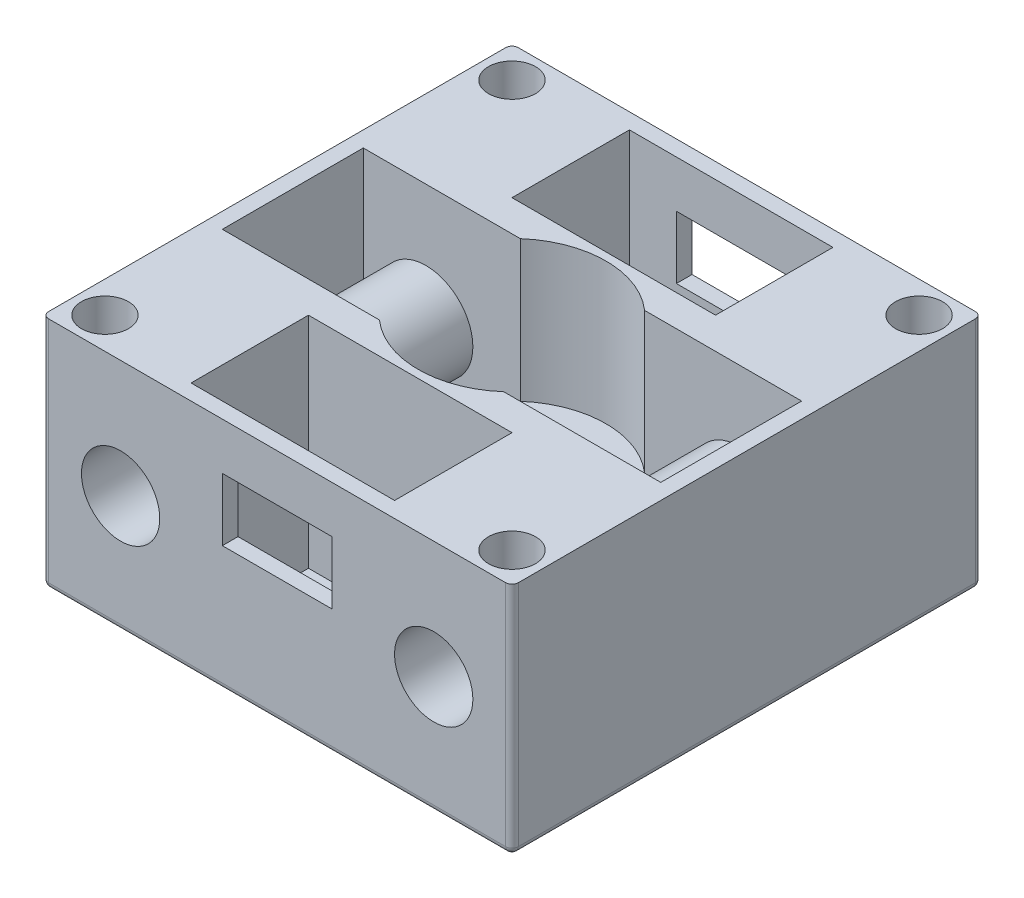
from build123d import *

# Parameters (mm, degrees)
SKETCH_2_W                      = 15
SKETCH_2_H                      = 15
EXTRUDE_1_DEPTH                 = 7.5
SKETCH_3_W                      = 14
SKETCH_3_H                      = 4.5
CUT_EXTRUDE_1_DEPTH             = 7
SKETCH_4_R                      = 3
CUT_EXTRUDE_2_DEPTH             = 4.5
SKETCH_5_W                      = 6.5
SKETCH_5_H                      = 3.75
CUT_EXTRUDE_3_DEPTH             = 7
EXTRUDE_2_REACH                 = 20.371
SKETCH_6_R                      = 1.5
SKETCH_7_R                      = 1.25
CUT_EXTRUDE_4_DEPTH             = 19.371173071
SKETCH_8_W                      = 3
SKETCH_8_H                      = 3
EXTRUDE_3_DEPTH                 = 1
CUT_EXTRUDE_5_REACH             = 20.371
SKETCH_9_W                      = 3.5
SKETCH_9_H                      = 2
CUT_EXTRUDE_6_REACH             = 35.371
CUT_EXTRUDE_START               = -15
SKETCH_9_2_W                    = 3.5
SKETCH_9_2_H                    = 2
EXTRUDE_4_DEPTH                 = 2
EXTRUDE_4_DEPTH_BACK            = 2
CUT_EXTRUDE_7_REACH             = 14.99
CUT_EXTRUDE_7_DIRECTION_2_REACH = 14.99
FILLET_1_R                      = 0.1
FILLET_2_R                      = 0.2
SKETCH_12_R                     = 0.75
CUT_EXTRUDE_8_DEPTH             = 2


with BuildPart() as part:
    # 草图2 → 凸台-拉伸1 (new body)
    with BuildSketch(Plane(origin=(0, 0, 0), x_dir=(1, 0, 0), z_dir=(0, 1, 0))):
        Rectangle(SKETCH_2_W, SKETCH_2_H)
    extrude(amount=EXTRUDE_1_DEPTH)

    # 草图3 → 切除-拉伸1 (cut)
    with BuildSketch(Plane(origin=(0, 7.5, 0), x_dir=(-1, 0, 0), z_dir=(0, 1, 0))):
        Rectangle(SKETCH_3_W, SKETCH_3_H)
    extrude(amount=-CUT_EXTRUDE_1_DEPTH, mode=Mode.SUBTRACT)

    # 草图4 → 切除-拉伸2 (cut)
    with BuildSketch(Plane(origin=(0, 7.5, 0), x_dir=(1, 0, 0), z_dir=(0, 1, 0))):
        Circle(SKETCH_4_R)
    extrude(amount=-CUT_EXTRUDE_2_DEPTH, mode=Mode.SUBTRACT)

    # 草图5 → 切除-拉伸3 (cut)
    with BuildSketch(Plane(origin=(0, 7.5, 0), x_dir=(-1, 0, 0), z_dir=(0, 1, 0))):
        with Locations((0, -5.125)):
            Rectangle(SKETCH_5_W, SKETCH_5_H)
        with Locations((0, 5.125)):
            Rectangle(SKETCH_5_W, SKETCH_5_H)
    extrude(amount=-CUT_EXTRUDE_3_DEPTH, mode=Mode.SUBTRACT)

    # 草图6 → 凸台-拉伸2 (add, up to next)
    with BuildSketch(Plane.XY.offset(7.5), mode=Mode.PRIVATE) as extrude_2_sk1:
        with Locations((-5, 3.75)):
            Circle(SKETCH_6_R)
    extrude_2_tool1 = extrude(extrude_2_sk1.sketch, amount=-EXTRUDE_2_REACH, mode=Mode.PRIVATE) - part.part
    # 草图6 → 凸台-拉伸2 (add, up to next)
    with BuildSketch(Plane.XY.offset(7.5), mode=Mode.PRIVATE) as extrude_2_sk2:
        with Locations((5, 3.75)):
            Circle(SKETCH_6_R)
    extrude_2_tool2 = extrude(extrude_2_sk2.sketch, amount=-EXTRUDE_2_REACH, mode=Mode.PRIVATE) - part.part
    add(extrude_2_tool1.solids().sort_by_distance((-5, 3.75, 7.5))[0])
    add(extrude_2_tool2.solids().sort_by_distance((5, 3.75, 7.5))[0])

    # 草图7 → 切除-拉伸4 (cut, through all)
    with BuildSketch(Plane.XY.offset(7.5)):
        with Locations((-5, 3.75)):
            Circle(SKETCH_7_R)
        with Locations((5, 3.75)):
            Circle(SKETCH_7_R)
    extrude(amount=-CUT_EXTRUDE_4_DEPTH, mode=Mode.SUBTRACT)

    # 草图8 → 凸台-拉伸3 (add)
    with BuildSketch(Plane.XZ):
        Rectangle(SKETCH_8_W, SKETCH_8_H)
    extrude(amount=EXTRUDE_3_DEPTH)

    # 草图9 → 切除-拉伸5 (cut, up to next)
    with BuildSketch(Plane.XY.offset(7.5), mode=Mode.PRIVATE) as cut_extrude_5_sk1:
        with Locations((0, 5)):
            Rectangle(SKETCH_9_W, SKETCH_9_H)
    cut_extrude_5_tool1 = extrude(cut_extrude_5_sk1.sketch, amount=-CUT_EXTRUDE_5_REACH, mode=Mode.PRIVATE) & part.part
    add(cut_extrude_5_tool1.solids().sort_by_distance((0, 5, 7.5))[0], mode=Mode.SUBTRACT)

    # 草图9<2> → 切除-拉伸6 (cut, up to next)
    with BuildSketch(Plane.XY.offset(7.5).offset(CUT_EXTRUDE_START), mode=Mode.PRIVATE) as cut_extrude_6_sk1:
        with Locations((0, 5)):
            Rectangle(SKETCH_9_2_W, SKETCH_9_2_H)
    cut_extrude_6_tool1 = extrude(cut_extrude_6_sk1.sketch, amount=CUT_EXTRUDE_6_REACH, mode=Mode.PRIVATE) & part.part
    add(cut_extrude_6_tool1.solids().sort_by_distance((0, 5, -7.5))[0], mode=Mode.SUBTRACT)

    # 草图10 → 凸台-拉伸4 (add, two sides: drawn at the far end of the back side and taken through both)
    with BuildSketch(Plane.XY.offset(-EXTRUDE_4_DEPTH_BACK)):
        with BuildLine():
            Line((-1.95, -2.5), (1.95, -2.5))
            Line((1.95, -2.5), (1.95, -1.555590279))
            ThreePointArc((1.95, -1.555590279), (1.780042303, -1.088161527), (1.5, -0.677124344))
            Line((1.5, -0.677124344), (-1.5, -0.677124344))
            ThreePointArc((-1.5, -0.677124344), (-1.780042303, -1.088161527), (-1.95, -1.555590279))
            Line((-1.95, -1.555590279), (-1.95, -2.5))
        make_face()
    extrude(amount=EXTRUDE_4_DEPTH + EXTRUDE_4_DEPTH_BACK)

    # 草图11 → 切除-拉伸7 (cut, up to next)
    with BuildSketch(Plane(origin=(0, 0, 0), x_dir=(0, 0, -1), z_dir=(1, 0, 0)), mode=Mode.PRIVATE) as cut_extrude_7_sk1:
        with BuildLine():
            Line((1.95, -2.5), (1.95, -1.555590279))
            ThreePointArc((1.95, -1.555590279), (1.780042303, -1.088161527), (1.5, -0.677124344))
            Line((1.5, -0.677124344), (2, -0.677124344))
            Line((2, -0.677124344), (2, -2.5))
            Line((2, -2.5), (1.95, -2.5))
        make_face()
    cut_extrude_7_tool1 = extrude(cut_extrude_7_sk1.sketch, amount=-CUT_EXTRUDE_7_REACH, mode=Mode.PRIVATE) & part.part
    # 草图11 → 切除-拉伸7 (cut, up to next)
    with BuildSketch(Plane(origin=(0, 0, 0), x_dir=(0, 0, -1), z_dir=(1, 0, 0)), mode=Mode.PRIVATE) as cut_extrude_7_sk2:
        with BuildLine():
            Line((-1.95, -2.5), (-1.95, -1.555590279))
            ThreePointArc((-1.95, -1.555590279), (-1.780042303, -1.088161527), (-1.5, -0.677124344))
            Line((-1.5, -0.677124344), (-2, -0.677124344))
            Line((-2, -0.677124344), (-2, -2.5))
            Line((-2, -2.5), (-1.95, -2.5))
        make_face()
    cut_extrude_7_tool2 = extrude(cut_extrude_7_sk2.sketch, amount=-CUT_EXTRUDE_7_REACH, mode=Mode.PRIVATE) & part.part
    add(cut_extrude_7_tool1.solids().sort_by_distance((0, -1.175075, -1.873038))[0], mode=Mode.SUBTRACT)
    add(cut_extrude_7_tool2.solids().sort_by_distance((0, -1.175075, 1.873038))[0], mode=Mode.SUBTRACT)

    # 草图11 → 切除-拉伸7 direction 2 (cut, up to next)
    with BuildSketch(Plane(origin=(0, 0, 0), x_dir=(0, 0, -1), z_dir=(1, 0, 0)), mode=Mode.PRIVATE) as cut_extrude_7_direction_2_sk1:
        with BuildLine():
            Line((1.95, -2.5), (1.95, -1.555590279))
            ThreePointArc((1.95, -1.555590279), (1.780042303, -1.088161527), (1.5, -0.677124344))
            Line((1.5, -0.677124344), (2, -0.677124344))
            Line((2, -0.677124344), (2, -2.5))
            Line((2, -2.5), (1.95, -2.5))
        make_face()
    cut_extrude_7_direction_2_tool1 = extrude(cut_extrude_7_direction_2_sk1.sketch, amount=CUT_EXTRUDE_7_DIRECTION_2_REACH, mode=Mode.PRIVATE) & part.part
    # 草图11 → 切除-拉伸7 direction 2 (cut, up to next)
    with BuildSketch(Plane(origin=(0, 0, 0), x_dir=(0, 0, -1), z_dir=(1, 0, 0)), mode=Mode.PRIVATE) as cut_extrude_7_direction_2_sk2:
        with BuildLine():
            Line((-1.95, -2.5), (-1.95, -1.555590279))
            ThreePointArc((-1.95, -1.555590279), (-1.780042303, -1.088161527), (-1.5, -0.677124344))
            Line((-1.5, -0.677124344), (-2, -0.677124344))
            Line((-2, -0.677124344), (-2, -2.5))
            Line((-2, -2.5), (-1.95, -2.5))
        make_face()
    cut_extrude_7_direction_2_tool2 = extrude(cut_extrude_7_direction_2_sk2.sketch, amount=CUT_EXTRUDE_7_DIRECTION_2_REACH, mode=Mode.PRIVATE) & part.part
    add(cut_extrude_7_direction_2_tool1.solids().sort_by_distance((0, -1.175075, -1.873038))[0], mode=Mode.SUBTRACT)
    add(cut_extrude_7_direction_2_tool2.solids().sort_by_distance((0, -1.175075, 1.873038))[0], mode=Mode.SUBTRACT)

    # 圆角1
    fillet_1_edges = [part.edges().sort_by_distance(p)[0] for p in [
        (0, -2.5, -1.95),
        (-1.95, -2.5, 0),
        (0, -2.5, 1.95),
        (1.95, -2.5, 0),
    ]]
    fillet(fillet_1_edges, radius=FILLET_1_R)

    # 圆角2
    fillet_2_edges = [part.edges().sort_by_distance(p)[0] for p in [
        (-7.5, 3.75, -7.5),
        (7.5, 3.75, -7.5),
        (-7.5, 3.75, 7.5),
        (-7.5, 0, 0),
        (0, 0, -7.5),
        (7.5, 0, 0),
        (0, 0, 7.5),
        (7.5, 3.75, 7.5),
    ]]
    fillet(fillet_2_edges, radius=FILLET_2_R)

    # 草图12 → 切除-拉伸8 (cut)
    with BuildSketch(Plane(origin=(0, 7.5, 0), x_dir=(-1, 0, 0), z_dir=(0, 1, 0))):
        with Locations((6.5, -6.5)):
            Circle(SKETCH_12_R)
        with Locations((-6.5, 6.5)):
            Circle(SKETCH_12_R)
        with Locations((6.5, 6.5)):
            Circle(SKETCH_12_R)
        with Locations((-6.5, -6.5)):
            Circle(SKETCH_12_R)
    extrude(amount=-CUT_EXTRUDE_8_DEPTH, mode=Mode.SUBTRACT)


solid = part.part
